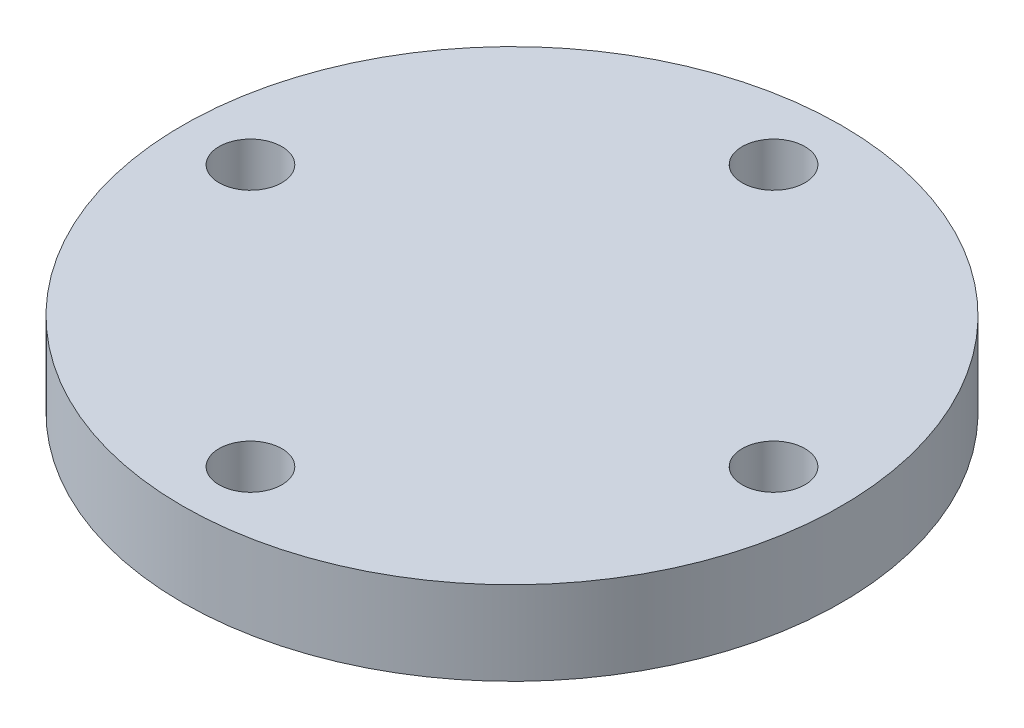
from build123d import *

# Parameters (mm, degrees)
SKETCH1_R           = 31.5
BOSS_EXTRUDE1_DEPTH = 8
SKETCH2_R           = 3
CUT_EXTRUDE1_DEPTH  = 46.260357931


with BuildPart() as part:
    # Sketch1 → Boss-Extrude1 (new body)
    with BuildSketch(Plane(origin=(0, 0, 0), x_dir=(1, 0, 0), z_dir=(0, 1, 0))):
        with Locations(Location((0, 0, 0), (0, 0, 270))):
            Circle(SKETCH1_R)
    extrude(amount=BOSS_EXTRUDE1_DEPTH)

    # Sketch2 → Cut-Extrude1 (cut, through all)
    with BuildSketch(Plane(origin=(0, 8, 0), x_dir=(1, 0, 0), z_dir=(0, 1, 0))):
        with Locations(Location((0, 25, 0), (0, 0, 270))):
            Circle(SKETCH2_R)
        with Locations(Location((-25, 0, 0), (0, 0, 270))):
            Circle(SKETCH2_R)
        with Locations(Location((0, -25, 0), (0, 0, 270))):
            Circle(SKETCH2_R)
        with Locations(Location((25, 0, 0), (0, 0, 270))):
            Circle(SKETCH2_R)
    extrude(amount=-CUT_EXTRUDE1_DEPTH, mode=Mode.SUBTRACT)


solid = part.part
